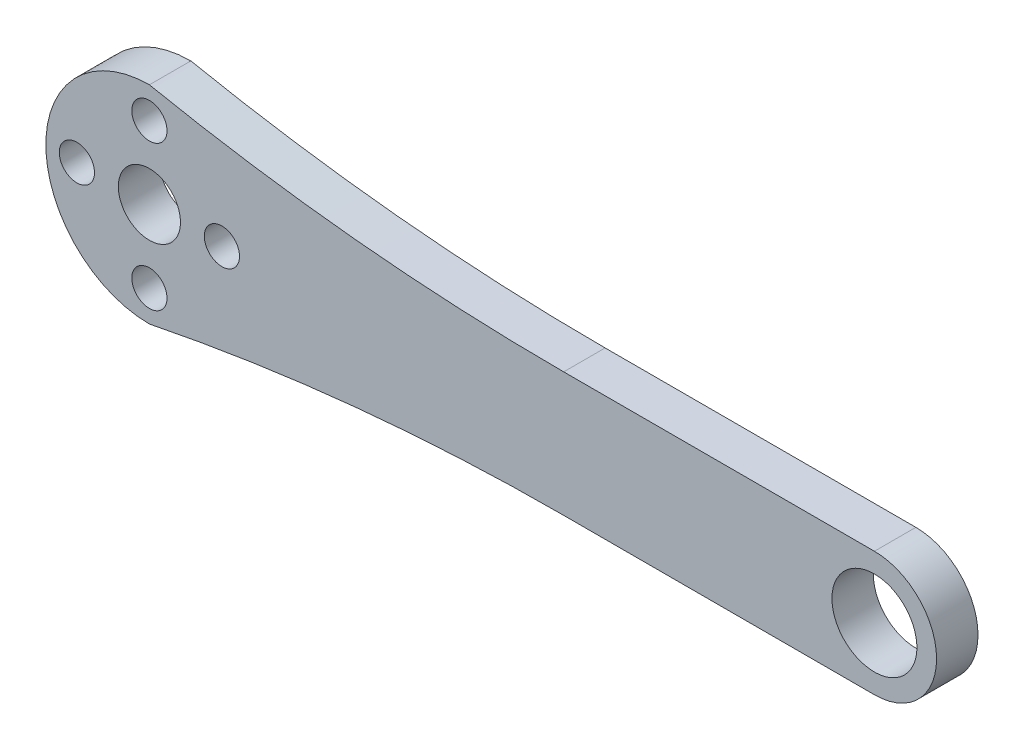
from build123d import *

# Parameters (mm, degrees)
SKETCH_1_R      = 1.7
SKETCH_1_R_2    = 3
SKETCH_1_R_3    = 4.1
EXTRUDE_1_DEPTH = 4


with BuildPart() as part:
    # 草图1 → 凸台-拉伸1 (new body)
    with BuildSketch(Plane.XY.offset(4)):
        with BuildLine():
            Line((40, -6), (70, -6))
            ThreePointArc((70, -6), (76.000000116, 1.16e-07), (70, 6.000000233))
            Line((70, 6.000000233), (39.999998847, 6.000000233))
            ThreePointArc((39.999998847, 6.000000233), (19.900249653, 7.002487606), (2.882e-06, 9.999999418))
            ThreePointArc((2.882e-06, 9.999999418), (-9.999999709, 1.15e-06), (0, -10))
            ThreePointArc((0, -10), (19.900248758, -7.002487578), (40, -6))
        make_face()
        with Locations(Location((0, 7, 0), (0, 0, 180))):
            Circle(SKETCH_1_R, mode=Mode.SUBTRACT)
        with Locations(Location((0, -2.91e-07, 0), (0, 0, 180))):
            Circle(SKETCH_1_R_2, mode=Mode.SUBTRACT)
        with Locations(Location((-7, 0, 0), (0, 0, 180))):
            Circle(SKETCH_1_R, mode=Mode.SUBTRACT)
        with Locations(Location((0, -7, 0), (0, 0, 180))):
            Circle(SKETCH_1_R, mode=Mode.SUBTRACT)
        with Locations(Location((7, 0, 0), (0, 0, 180))):
            Circle(SKETCH_1_R, mode=Mode.SUBTRACT)
        with Locations(Location((70, 1.16e-07, 0), (0, 0, 180))):
            Circle(SKETCH_1_R_3, mode=Mode.SUBTRACT)
    extrude(amount=-EXTRUDE_1_DEPTH)


solid = part.part
